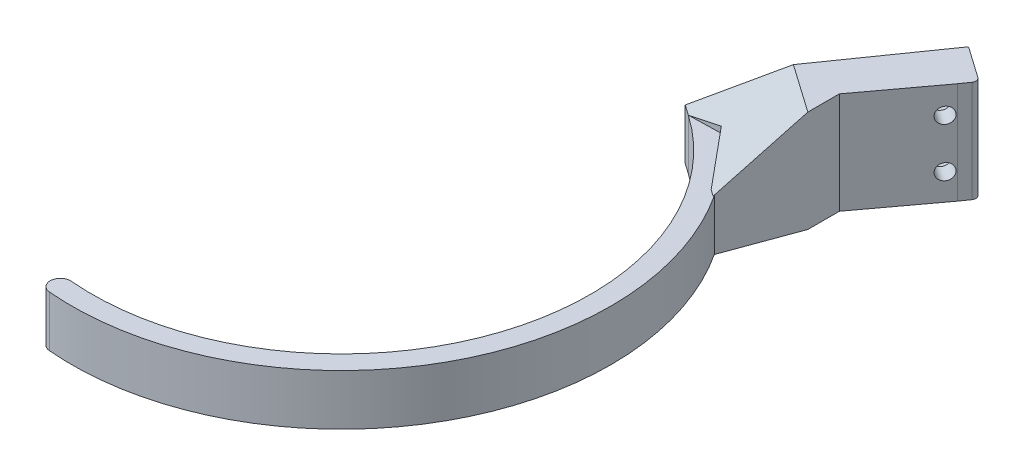
from build123d import *

# Parameters (mm, degrees)
EXTRUDE_5_DEPTH     = 20
SKETCH_4_R          = 1.55
CUT_EXTRUDE_1_DEPTH = 10
CUT_EXTRUDE_2_DEPTH = 5
CUT_EXTRUDE_START   = -5
CUT_EXTRUDE_3_DEPTH = 5
CUT_EXTRUDE_4_DEPTH = 5
EXTRUDE_7_DEPTH     = 20
CUT_EXTRUDE_6_DEPTH = 30
CUT_EXTRUDE_START_2 = -10
SKETCH_11_R         = 1
CUT_EXTRUDE_7_DEPTH = 10
EXTRUDE_8_DEPTH     = 10


with BuildPart() as part:
    # 草图1 → 凸台-拉伸5 (new body)
    with BuildSketch(Plane(origin=(0, 0, 0), x_dir=(1, 0, 0), z_dir=(0, 1, 0))):
        with BuildLine():
            Line((-9.02810898, 9.014963713), (-9.601685416, 8.195811669))
            Line((-9.601685416, 8.195811669), (-7.553805305, 6.761870578))
            ThreePointArc((-7.553805305, 6.761870578), (4.479399484, -61.481824974), (-63.764296068, -73.515029763))
            Line((-63.764296068, -73.515029763), (-66.058601813, -76.79163794))
            ThreePointArc((-66.058601813, -76.79163794), (6.240788915, -65.832756837), (-1.221646395, 6.910703583))
            Line((-1.221646395, 6.910703583), (18.546430176, 33.576189082))
            Line((18.546430176, 33.576189082), (19.730587978, 35.267341687))
            ThreePointArc((19.730587978, 35.267341687), (19.896243687, 36.014566301), (19.48501237, 36.660070167))
            Line((19.48501237, 36.660070167), (13.341372038, 40.96189344))
            Line((13.341372038, 40.96189344), (-7.880956107, 10.653267801))
            Line((-7.880956107, 10.653267801), (-8.454532543, 9.834115757))
            Line((-8.454532543, 9.834115757), (-9.02810898, 9.014963713))
        make_face()
    extrude(amount=EXTRUDE_5_DEPTH)

    # 草图4 → 切除-拉伸1 (cut)
    with BuildSketch(Plane(origin=(-10.293599492, 0, -7.20765596), x_dir=(-0.5735764363510502, 0, 0.8191520442889891), z_dir=(-0.8191520442889891, 0, -0.5735764363510502))):
        with Locations((-36.406315379, 14.8)):
            Circle(SKETCH_4_R)
        with Locations((-36.406315379, 5.2)):
            Circle(SKETCH_4_R)
    extrude(amount=-CUT_EXTRUDE_1_DEPTH, mode=Mode.SUBTRACT)

    # 草图4<4> → 切除-拉伸2 (cut)
    with BuildSketch(Plane(origin=(-10.293599492, 0, -7.20765596), x_dir=(-0.5735764363510502, 0, 0.8191520442889891), z_dir=(-0.8191520442889891, 0, -0.5735764363510502))):
        Polygon((-34.71546965, 11.84291122), (-32.99997851, 14.785770965), (-34.690824239, 17.742859745), (-38.097161108, 17.75708878), (-39.812652248, 14.814229035), (-38.121806519, 11.857140255), align=None)
        Polygon((-34.611807013, 2.304646298), (-33.001611337, 5.306412981), (-34.796119703, 8.201766683), (-38.200823744, 8.095353702), (-39.811019421, 5.093587019), (-38.016511055, 2.198233317), align=None)
    extrude(amount=-CUT_EXTRUDE_2_DEPTH, mode=Mode.SUBTRACT)

    # 草图5 → 切除-拉伸3 (cut)
    with BuildSketch(Plane(origin=(0, 20, 0), x_dir=(1, 0, 0), z_dir=(0, 1, 0)).offset(CUT_EXTRUDE_START)):
        with BuildLine():
            ThreePointArc((-7.553805305, 6.761870578), (4.479399484, -61.481824974), (-63.764296068, -73.515029763))
            Line((-63.764296068, -73.515029763), (-66.058601813, -76.79163794))
            ThreePointArc((-66.058601813, -76.79163794), (6.240788915, -65.832756837), (-1.221646395, 6.910703583))
            Line((-1.221646395, 6.910703583), (-7.553805305, 6.761870578))
        make_face()
    extrude(amount=CUT_EXTRUDE_3_DEPTH, mode=Mode.SUBTRACT)

    # 草图6 → 切除-拉伸4 (cut)
    with BuildSketch(Plane.XZ):
        with BuildLine():
            ThreePointArc((-1.221646395, -6.910703583), (6.240788915, 65.832756837), (-66.058601813, 76.79163794))
            Line((-66.058601813, 76.79163794), (-63.764296068, 73.515029763))
            ThreePointArc((-63.764296068, 73.515029763), (4.479399484, 61.481824974), (-7.553805305, -6.761870578))
            Line((-7.553805305, -6.761870578), (-1.221646395, -6.910703583))
        make_face()
    extrude(amount=-CUT_EXTRUDE_4_DEPTH, mode=Mode.SUBTRACT)

    # 草图9 → 凸台-拉伸7 (add)
    with BuildSketch(Plane(origin=(0, 0, 0), x_dir=(1, 0, 0), z_dir=(0, 1, 0))):
        Polygon((8.662391891, 20.243446333), (-1.221646395, 6.910703583), (8.662391891, -5.275766787), align=None)
    extrude(amount=EXTRUDE_7_DEPTH)

    # 草图7 → 切除-拉伸6 (cut)
    with BuildSketch(Plane(origin=(-10.293599492, 0, -7.20765596), x_dir=(-0.5735764363510472, 0, 0.819152044288991), z_dir=(-0.819152044288991, 0, -0.5735764363510472))):
        Polygon((-1.206315379, 5), (-16.473642116, 0), (0, 0), (28.572588785, 0), (28.572588785, 5), align=None)
        Polygon((-1.206315379, 20), (-16.473642116, 20), (-1.206315379, 15), (28.572588785, 15), (28.572588785, 20), align=None)
    extrude(amount=-CUT_EXTRUDE_6_DEPTH, mode=Mode.SUBTRACT)

    # 草图11 → 切除-拉伸7 (cut)
    with BuildSketch(Plane(origin=(0, 15, 0), x_dir=(1, 0, 0), z_dir=(0, 1, 0)).offset(CUT_EXTRUDE_START_2)):
        with Locations((-34.481669179, -37.284707791)):
            Circle(SKETCH_11_R)
        with BuildLine():
            Line((-63.764296068, -73.515029763), (-66.058601813, -76.79163794))
            ThreePointArc((-66.058601813, -76.79163794), (-53.786118283, -83.180288494), (-40.278305052, -86.174898591))
            Line((-40.278305052, -86.174898591), (-39.929682081, -82.190119799))
            ThreePointArc((-39.929682081, -82.190119799), (-52.41803771, -79.421518011), (-63.764296068, -73.515029763))
        make_face()
    extrude(amount=CUT_EXTRUDE_7_DEPTH, mode=Mode.SUBTRACT)

    # 草图18 → 凸台-拉伸8 (add)
    with BuildSketch(Plane(origin=(0, 15, 0), x_dir=(1, 0, 0), z_dir=(0, 1, 0))):
        with BuildLine():
            ThreePointArc((-39.929682081, -82.190119799), (-42.096382963, -84.00819771), (-40.278305052, -86.174898591))
            Line((-40.278305052, -86.174898591), (-39.929682081, -82.190119799))
        make_face()
    extrude(amount=-EXTRUDE_8_DEPTH)


solid = part.part
